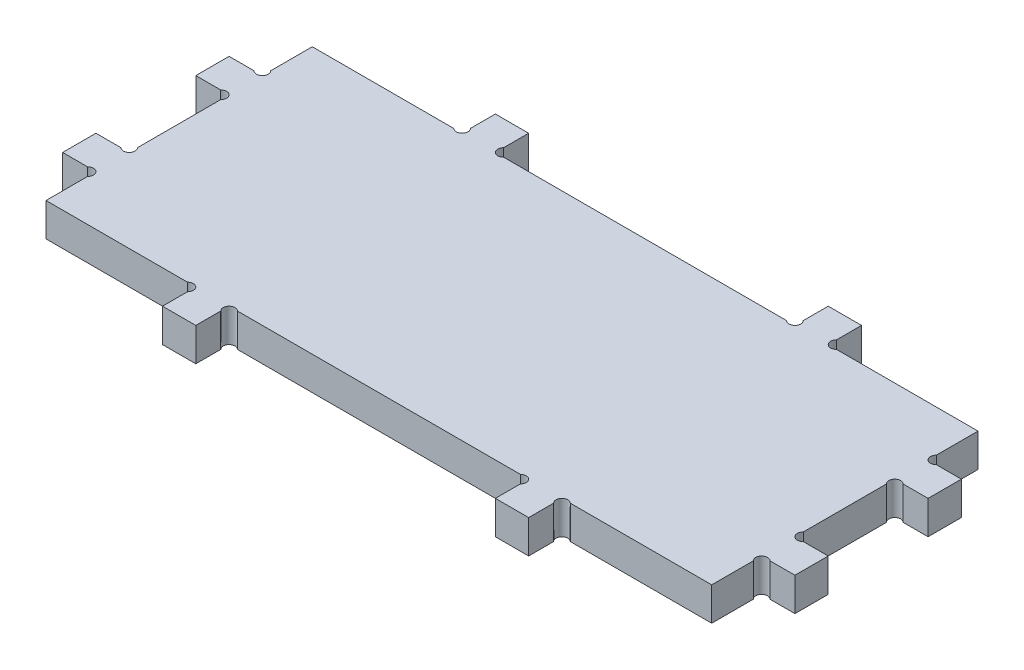
from build123d import *

# Parameters (mm, degrees)
SKETCH2_W                  = 254
SKETCH2_H                  = 101.6
RECTANGLE_EXTRUSION_DEPTH  = 12.7
SKETCH4_W                  = 12.7
SKETCH4_H                  = 12.7
FRONT_FACE_TABS_DEPTH      = 12.7
SKETCH6_R                  = 2.24536
TAB_CURVE_FRONT_BACK_DEPTH = 12.7
SKETCH7_W                  = 12.7
SKETCH7_H                  = 12.7
RIGHT_FACE_TABS_DEPTH      = 12.7
SKETCH8_R                  = 2.24536
TAB_CURVE_LEFT_RIGHT_DEPTH = 12.7


with BuildPart() as part:
    # Sketch2 → Rectangle Extrusion (new body)
    with BuildSketch(Plane(origin=(0, 0, 0), x_dir=(1, 0, 0), z_dir=(0, 1, 0))):
        Rectangle(SKETCH2_W, SKETCH2_H)
    extrude(amount=RECTANGLE_EXTRUSION_DEPTH)

    # Sketch4 → Front Face Tabs (add)
    with BuildSketch(Plane.XY.offset(50.8)):
        with Locations((-63.5, 6.35)):
            Rectangle(SKETCH4_W, SKETCH4_H)
        with Locations((63.5, 6.35)):
            Rectangle(SKETCH4_W, SKETCH4_H)
    front_face_tabs = extrude(amount=FRONT_FACE_TABS_DEPTH)

    # Mirror Rear Face Tabs: Front Face Tabs across plane
    add(front_face_tabs.mirror(Plane.XY))

    # Sketch6 → Tab Curve Front Back (cut)
    with BuildSketch(Plane(origin=(0, 12.7, 0), x_dir=(1, 0, 0), z_dir=(0, 1, 0))):
        with Locations((-71.4375, 52.3875)):
            Circle(SKETCH6_R)
        with Locations((-55.5625, 52.3875)):
            Circle(SKETCH6_R)
        with Locations((55.5625, 52.3875)):
            Circle(SKETCH6_R)
        with Locations((71.4375, 52.3875)):
            Circle(SKETCH6_R)
        with Locations((71.4375, -52.3875)):
            Circle(SKETCH6_R)
        with Locations((55.5625, -52.3875)):
            Circle(SKETCH6_R)
        with Locations((-55.5625, -52.3875)):
            Circle(SKETCH6_R)
        with Locations((-71.4375, -52.3875)):
            Circle(SKETCH6_R)
    extrude(amount=-TAB_CURVE_FRONT_BACK_DEPTH, mode=Mode.SUBTRACT)

    # Sketch7 → Right Face Tabs (add)
    with BuildSketch(Plane(origin=(127, 0, 0), x_dir=(0, 0, -1), z_dir=(1, 0, 0))):
        with Locations((-25.4, 6.35)):
            Rectangle(SKETCH7_W, SKETCH7_H)
        with Locations((25.4, 6.35)):
            Rectangle(SKETCH7_W, SKETCH7_H)
    right_face_tabs = extrude(amount=RIGHT_FACE_TABS_DEPTH)

    # Mirror Left Face Tabs: Right Face Tabs across plane
    add(right_face_tabs.mirror(Plane(origin=(0, 0, 0), x_dir=(0, 0, 1), z_dir=(1, 0, 0))))

    # Sketch8 → Tab Curve Left Right (cut)
    with BuildSketch(Plane(origin=(0, 12.7, 0), x_dir=(1, 0, 0), z_dir=(0, 1, 0))):
        with Locations((128.5875, 33.3375)):
            Circle(SKETCH8_R)
        with Locations((128.5875, 17.4625)):
            Circle(SKETCH8_R)
        with Locations((128.5875, -17.4625)):
            Circle(SKETCH8_R)
        with Locations((128.5875, -33.3375)):
            Circle(SKETCH8_R)
        with Locations((-128.5875, -33.3375)):
            Circle(SKETCH8_R)
        with Locations((-128.5875, -17.4625)):
            Circle(SKETCH8_R)
        with Locations((-128.5875, 17.4625)):
            Circle(SKETCH8_R)
        with Locations((-128.5875, 33.3375)):
            Circle(SKETCH8_R)
    extrude(amount=-TAB_CURVE_LEFT_RIGHT_DEPTH, mode=Mode.SUBTRACT)


solid = part.part
